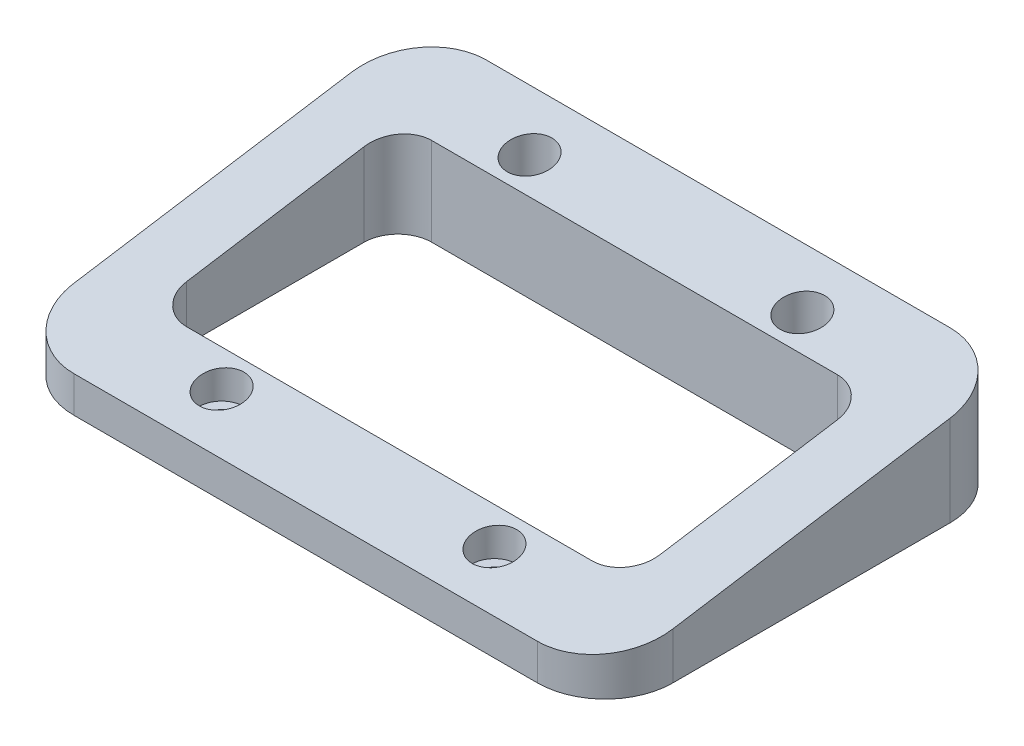
from build123d import *

# Parameters (mm, degrees)
BOSS_EXTRUDE1_DEPTH            = 15.24
CUT_EXTRUDE1_DEPTH             = 97.554341556
CBORE_FOR_M3_SBHCS2_AT_2_COUNT = 2
CBORE_FOR_M3_SBHCS2_AT_2_PITCH = 41.005
CBORE_FOR_M3_SBHCS2_AT_3_COUNT = 2
CBORE_FOR_M3_SBHCS2_AT_3_PITCH = 61.832422118
CBORE_FOR_M3_SBHCS2_AT_4_COUNT = 2
CBORE_FOR_M3_SBHCS2_AT_4_PITCH = 46.28
SKETCH16_R                     = 3.35
CUT_EXTRUDE2_DEPTH             = 98.872548965


with BuildPart() as part:
    # Sketch2 → Boss-Extrude1 (new body)
    with BuildSketch(Plane(origin=(0, 0, 0), x_dir=(1, 0, 0), z_dir=(0, 1, 0))):
        with BuildLine():
            Line((81.8747525, 30.528055776), (12.1947525, 30.528055776))
            ThreePointArc((12.1947525, 30.528055776), (5.010547603, 27.552260673), (2.0347525, 20.368055776))
            Line((2.0347525, 20.368055776), (2.0347525, -21.311944224))
            ThreePointArc((2.0347525, -21.311944224), (5.010547603, -28.496149121), (12.1947525, -31.471944224))
            Line((12.1947525, -31.471944224), (81.8747525, -31.471944224))
            ThreePointArc((81.8747525, -31.471944224), (89.058957397, -28.496149121), (92.0347525, -21.311944224))
            Line((92.0347525, -21.311944224), (92.0347525, 20.368055776))
            ThreePointArc((92.0347525, 20.368055776), (89.058957397, 27.552260673), (81.8747525, 30.528055776))
        make_face()
        with BuildLine():
            Line((16.5547525, 17.943055776), (77.5147525, 17.943055776))
            ThreePointArc((77.5147525, 17.943055776), (81.106854948, 16.455158224), (82.5947525, 12.863055776))
            Line((82.5947525, 12.863055776), (82.5947525, -13.806944224))
            ThreePointArc((82.5947525, -13.806944224), (81.106854948, -17.399046672), (77.5147525, -18.886944224))
            Line((77.5147525, -18.886944224), (16.5547525, -18.886944224))
            ThreePointArc((16.5547525, -18.886944224), (12.962650051, -17.399046672), (11.4747525, -13.806944224))
            Line((11.4747525, -13.806944224), (11.4747525, 12.863055776))
            ThreePointArc((11.4747525, 12.863055776), (12.962650051, 16.455158224), (16.5547525, 17.943055776))
        make_face(mode=Mode.SUBTRACT)
    extrude(amount=BOSS_EXTRUDE1_DEPTH)

    # Sketch3 → Cut-Extrude1 (cut, through all)
    with BuildSketch(Plane.ZY.offset(-2.0347525)):
        Polygon((21.311944224, 15.24), (-20.368055776, 15.24), (-30.528055776, 15.24), (31.471944224, 5.4201647), (31.471944224, 15.24), align=None)
    extrude(amount=-CUT_EXTRUDE1_DEPTH, mode=Mode.SUBTRACT)

    # Sketch15 → CBORE for M3 SBHCS2 (revolve, cut)
    with BuildSketch(Plane(origin=(67.5372525, 4.37, 23.611944224), x_dir=(0, 0, 1), z_dir=(1, 0, 0))):
        Polygon((0, 0), (0, 4.37), (1.8, 4.37), (1.8, 1.65), (3.35, 1.65), (3.35, 0), align=None)
    cbore_for_m3_sbhcs2 = revolve(axis=Axis((67.5372525, 10.72, 23.611944224), (0, -1, 0)), mode=Mode.SUBTRACT)

    # CBORE for M3 SBHCS2 at 2: CBORE for M3 SBHCS2 ×2
    with Locations(*[(-i * CBORE_FOR_M3_SBHCS2_AT_2_PITCH, 0, 0) for i in range(1, CBORE_FOR_M3_SBHCS2_AT_2_COUNT)]):
        add(cbore_for_m3_sbhcs2, mode=Mode.SUBTRACT)

    # CBORE for M3 SBHCS2 at 3: CBORE for M3 SBHCS2 ×2
    with Locations(*[Vector(-0.6631634116100382, 0, -0.7484746418561787) * (i * CBORE_FOR_M3_SBHCS2_AT_3_PITCH) for i in range(1, CBORE_FOR_M3_SBHCS2_AT_3_COUNT)]):
        add(cbore_for_m3_sbhcs2, mode=Mode.SUBTRACT)

    # CBORE for M3 SBHCS2 at 4: CBORE for M3 SBHCS2 ×2
    with Locations(*[(0, 0, -i * CBORE_FOR_M3_SBHCS2_AT_4_PITCH) for i in range(1, CBORE_FOR_M3_SBHCS2_AT_4_COUNT)]):
        add(cbore_for_m3_sbhcs2, mode=Mode.SUBTRACT)

    # Sketch16 → Cut-Extrude2 (cut, through all)
    with BuildSketch(Plane(origin=(0, 4.37, 0), x_dir=(-1, 0, 0), z_dir=(0, -1, 0))):
        with Locations(Location((-67.5372525, -23.611944224, 0), (0, 0, 270))):
            Circle(SKETCH16_R)
        with Locations(Location((-26.5322525, -23.611944224, 0), (0, 0, 270))):
            Circle(SKETCH16_R)
        with Locations(Location((-67.5372525, 22.668055776, 0), (0, 0, 270))):
            Circle(SKETCH16_R)
        with Locations(Location((-26.5322525, 22.668055776, 0), (0, 0, 270))):
            Circle(SKETCH16_R)
    extrude(amount=-CUT_EXTRUDE2_DEPTH, mode=Mode.SUBTRACT)


solid = part.part
